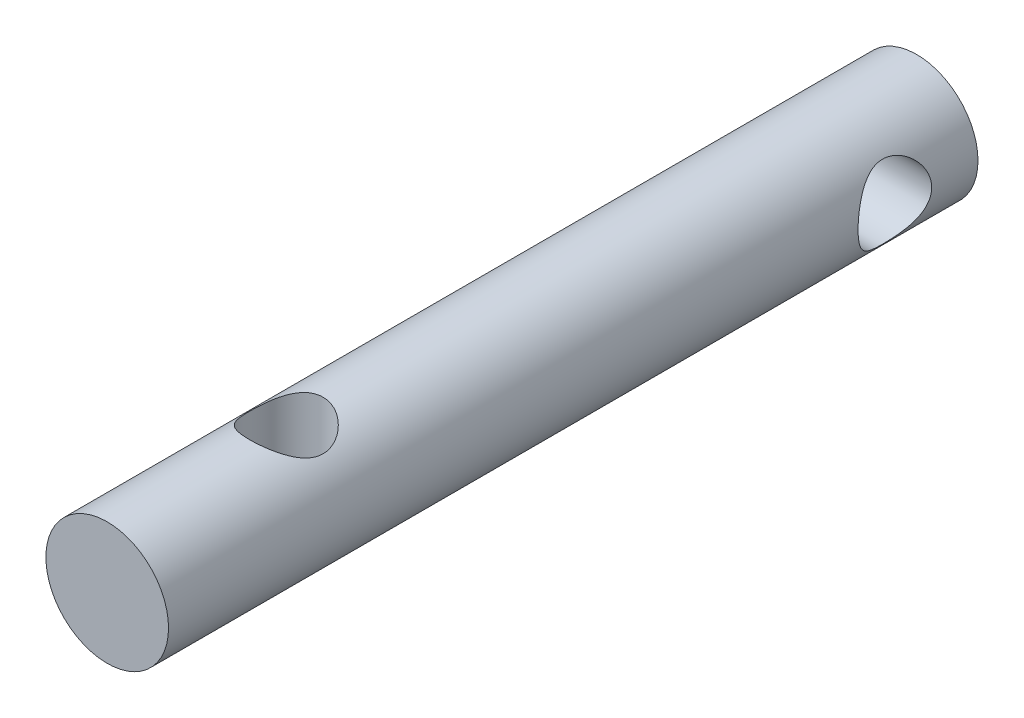
from build123d import *

# Parameters (mm, degrees)
SKETCH1_R               = 3.175
BOSS_EXTRUDE1_DEPTH     = 41.91
CUT_EXTRUDE1_DEPTH      = 43.149844009
CUT_EXTRUDE1_DEPTH_BACK = 43.149844009
SKETCH2_R               = 1.905
CUT_EXTRUDE2_DEPTH      = 43.149844124
CUT_EXTRUDE2_DEPTH_BACK = 43.149844124
SKETCH3_R               = 1.905


with BuildPart() as part:
    # Sketch1 → Boss-Extrude1 (new body)
    with BuildSketch(Plane.XY):
        Circle(SKETCH1_R)
    extrude(amount=BOSS_EXTRUDE1_DEPTH)

    # Sketch2 → Cut-Extrude1 (cut, two sides: drawn at the far end of the back side and taken through both)
    with BuildSketch(Plane(origin=(0, 0, 0), x_dir=(1, 0, 0), z_dir=(0, 1, 0)).offset(-CUT_EXTRUDE1_DEPTH_BACK)):
        with Locations(Location((0, -32.639, 0), (0, 0, 270))):
            Circle(SKETCH2_R)
    extrude(amount=CUT_EXTRUDE1_DEPTH + CUT_EXTRUDE1_DEPTH_BACK, mode=Mode.SUBTRACT)

    # Sketch3 → Cut-Extrude2 (cut, two sides: drawn at the far end of the back side and taken through both)
    with BuildSketch(Plane(origin=(0, 0, 0), x_dir=(0, 0, -1), z_dir=(1, 0, 0)).offset(-CUT_EXTRUDE2_DEPTH_BACK)):
        with Locations((-4.303139223, 0)):
            Circle(SKETCH3_R)
    extrude(amount=CUT_EXTRUDE2_DEPTH + CUT_EXTRUDE2_DEPTH_BACK, mode=Mode.SUBTRACT)


solid = part.part
